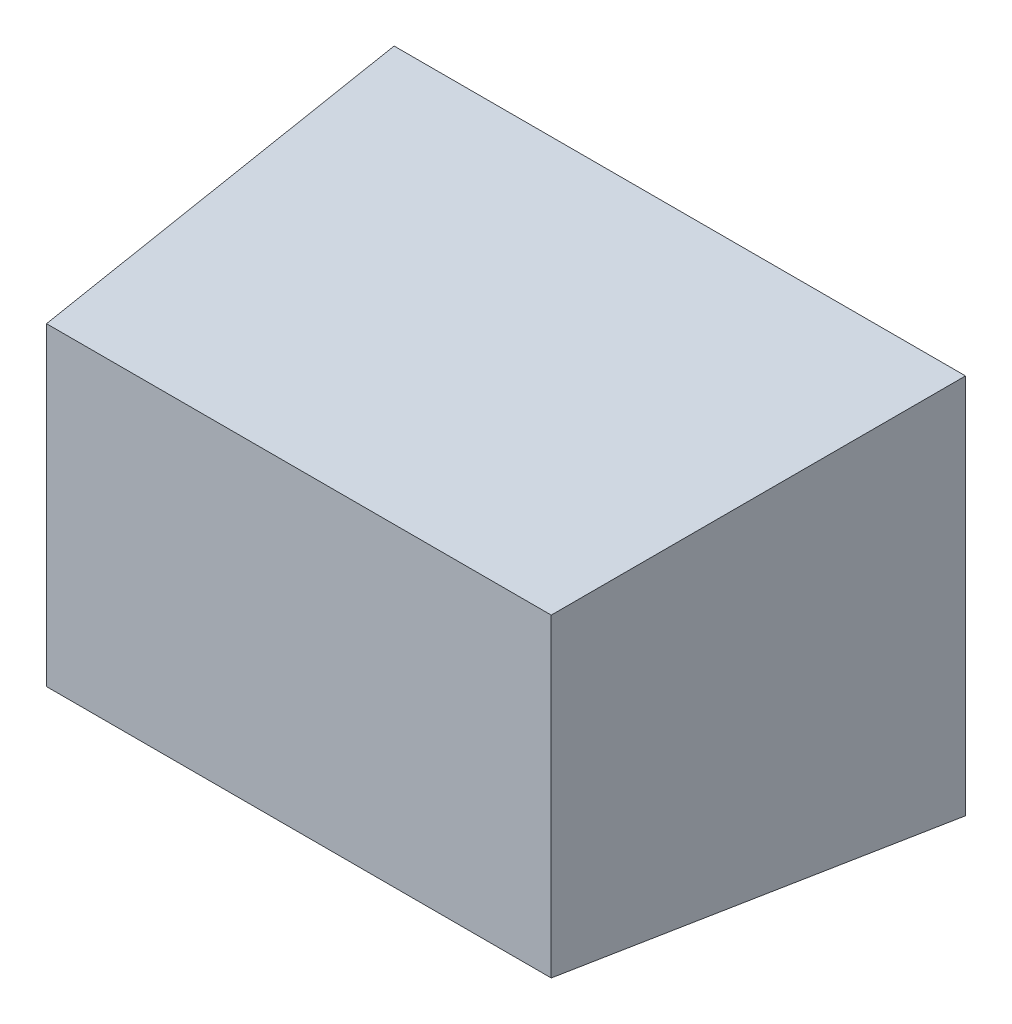
from build123d import *

# Parameters (mm, degrees)
SKETCH1_W           = 150
SKETCH1_H           = 100
BOSS_EXTRUDE1_DEPTH = 100
BOSS_EXTRUDE1_TAPER = 5


with BuildPart() as part:
    # Sketch1 → Boss-Extrude1 (new body)
    with BuildSketch(Plane.XY):
        Rectangle(SKETCH1_W, SKETCH1_H)
    extrude(amount=BOSS_EXTRUDE1_DEPTH, taper=BOSS_EXTRUDE1_TAPER)


solid = part.part
